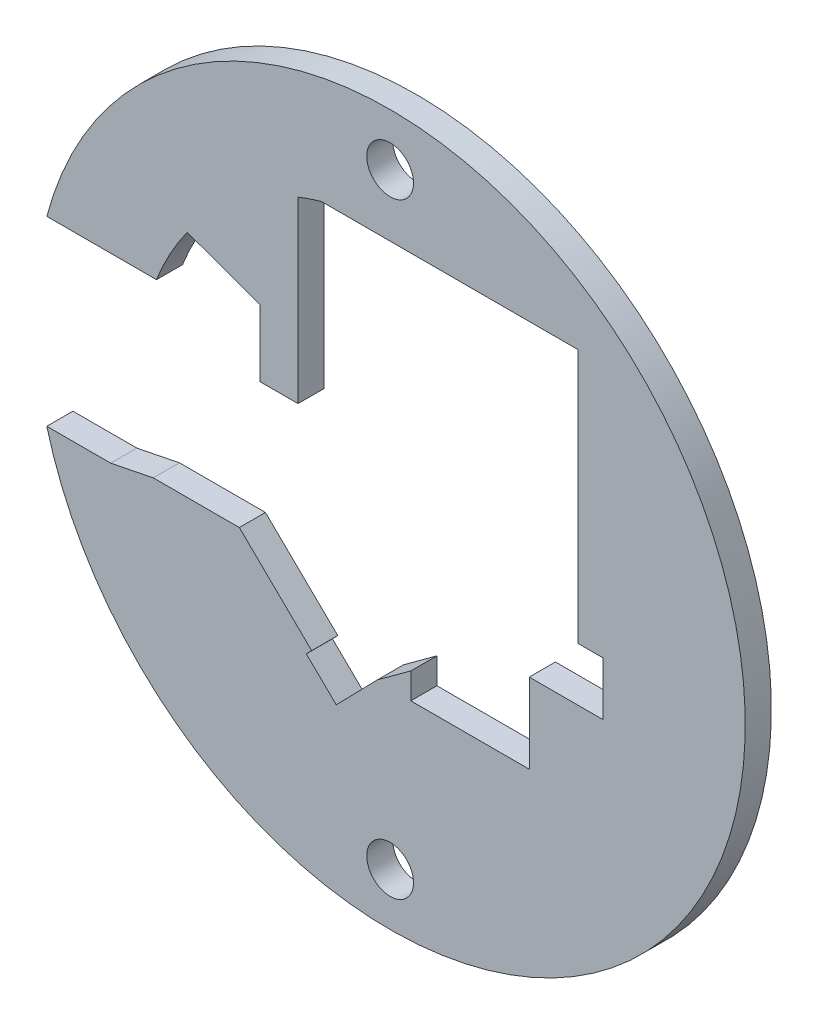
from build123d import *

# Parameters (mm, degrees)
SKETCH1_R           = 1.4224
BOSS_EXTRUDE1_DEPTH = 1.5875
CUT_EXTRUDE1_DEPTH  = 31.574112518


with BuildPart() as part:
    # Sketch1 → Boss-Extrude1 (new body)
    with BuildSketch(Plane.XY):
        with BuildLine():
            Line((-14.952058744, -2.948480848), (-16.984058744, -2.948480848))
            Line((-16.984058744, -2.948480848), (-16.984058744, -5.5245))
            Line((-16.984058744, -5.5245), (-20.871224203, -5.5245))
            ThreePointArc((-20.871224203, -5.5245), (21.59, 0), (-20.871224203, 5.5245))
            Line((-20.871224203, 5.5245), (-16.984058744, 5.5245))
            Line((-16.984058744, 5.5245), (-16.984058744, 2.948480848))
            Line((-16.984058744, 2.948480848), (-14.952058744, 2.948480848))
            ThreePointArc((-14.952058744, 2.948480848), (-13.968818521, 6.093415226), (-12.332576282, 8.9535))
            Line((-12.332576282, 8.9535), (-7.9248, 7.366))
            Line((-7.9248, 7.366), (-7.9248, 3.302))
            Line((-7.9248, 3.302), (-5.6007, 3.302))
            Line((-5.6007, 3.302), (-5.6007, 14.173558463))
            ThreePointArc((-5.6007, 14.173558463), (-4.895856129, 14.43219293), (-4.179129857, 14.6558))
            Line((-4.179129857, 14.6558), (4.179129857, 14.6558))
            Line((4.179129857, 14.6558), (11.43, 14.6558))
            Line((11.43, 14.6558), (11.43, -0.8128))
            Line((11.43, -0.8128), (12.9413, -0.8128))
            Line((12.9413, -0.8128), (12.9413, -4.064))
            Line((12.9413, -4.064), (8.4582, -4.064))
            Line((8.4582, -4.064), (8.4582, -8.9154))
            Line((8.4582, -8.9154), (1.2573, -8.9154))
            Line((1.2573, -8.9154), (1.2573, -7.3406))
            Line((1.2573, -7.3406), (-0.7747, -8.8265))
            Line((-0.7747, -8.8265), (-3.273729572, -11.3919))
            Line((-3.273729572, -11.3919), (-5.093162196, -9.619538602))
            Line((-5.093162196, -9.619538602), (-4.769706241, -9.287492148))
            Line((-4.769706241, -9.287492148), (-9.167166743, -5.0038))
            Line((-9.167166743, -5.0038), (-14.395123673, -5.0038))
            ThreePointArc((-14.395123673, -5.0038), (-14.709533071, -3.985879682), (-14.952058744, -2.948480848))
        make_face()
        with Locations((0, 18.415)):
            Circle(SKETCH1_R, mode=Mode.SUBTRACT)
        with Locations((0, -18.415)):
            Circle(SKETCH1_R, mode=Mode.SUBTRACT)
    extrude(amount=BOSS_EXTRUDE1_DEPTH)

    # Sketch2 → Cut-Extrude1 (cut, through all)
    with BuildSketch(Plane.XY.offset(1.5875)):
        Polygon((-14.395123673, -5.0038), (-16.984058744, -5.5245), (-16.984058744, 5.5245), (-14.203432675, 5.5245), align=None)
    extrude(amount=-CUT_EXTRUDE1_DEPTH, mode=Mode.SUBTRACT)


solid = part.part
